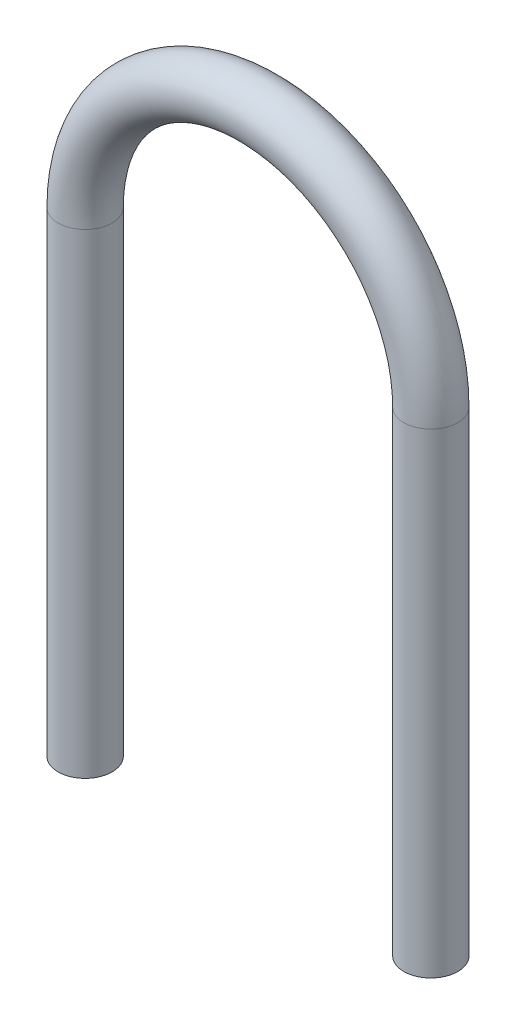
from build123d import *

# Parameters (mm, degrees)
ESQUISSE4_R = 3.96875


with BuildPart() as part:
    # Balayage1: sweep along a path in Esquisse1
    with BuildLine(Plane.XY) as balayage1_path:
        Line((-25.4, -69.85), (-25.4, 0))
        ThreePointArc((-25.4, 0), (0, 25.4), (25.4, 0))
        Line((25.4, 0), (25.4, -69.85))
    # Esquisse4 → Balayage1 (sweep)
    with BuildSketch(Plane(origin=(0, -69.85, 0), x_dir=(-1, 0, 0), z_dir=(0, 1, 0))):
        with Locations((-25.4, 0)):
            Circle(ESQUISSE4_R)
    sweep(path=balayage1_path.line)


solid = part.part
